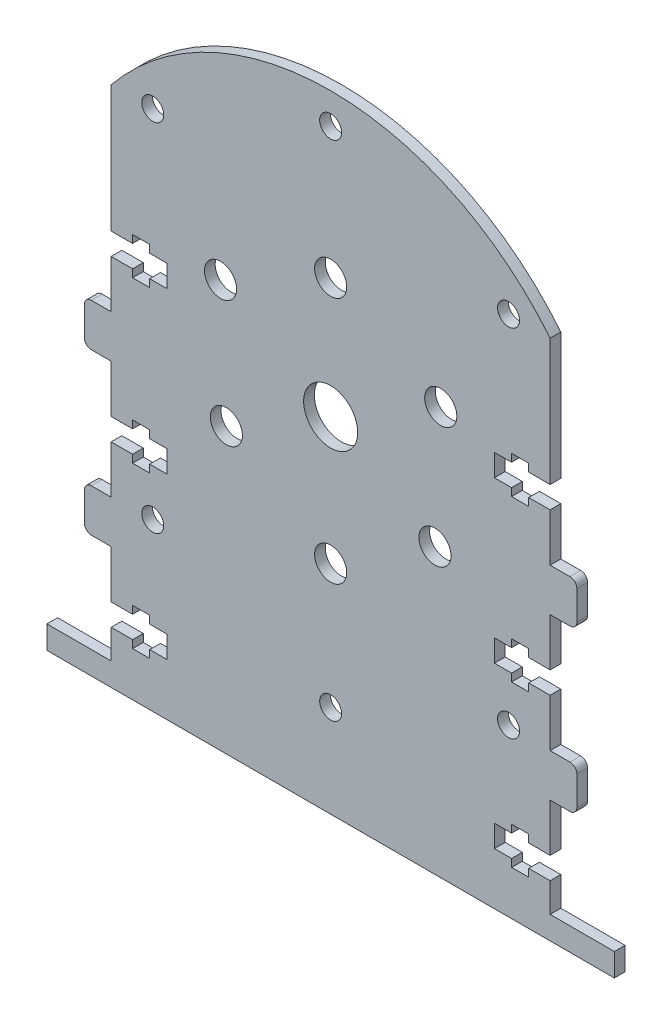
from build123d import *

# Parameters (mm, degrees)
SKETCH_1_R      = 3
SKETCH_1_R_2    = 5.05
SKETCH_1_R_3    = 2.05
EXTRUDE_2_DEPTH = 2
FILLET_1_R      = 1.3


with BuildPart() as part:
    # 草图1 → 凸台-拉伸2 (new body)
    with BuildSketch(Plane.XY):
        with BuildLine():
            Line((-55.962487977, 23.496493589), (-55.962487977, 8.046493589))
            Line((-55.962487977, 8.046493589), (-51.962487977, 8.046493589))
            Line((-51.962487977, 8.046493589), (-51.962487977, 9.496493589))
            Line((-51.962487977, 9.496493589), (-48.762487977, 9.496493589))
            Line((-48.762487977, 9.496493589), (-48.762487977, 8.046493589))
            Line((-48.762487977, 8.046493589), (-45.562487977, 8.046493589))
            Line((-45.562487977, 8.046493589), (-45.562487977, 3.946493589))
            Line((-45.562487977, 3.946493589), (-48.762487977, 3.946493589))
            Line((-48.762487977, 3.946493589), (-48.762487977, 2.496493589))
            Line((-48.762487977, 2.496493589), (-51.962487977, 2.496493589))
            Line((-51.962487977, 2.496493589), (-51.962487977, 3.946493589))
            Line((-51.962487977, 3.946493589), (-55.962487977, 3.946493589))
            Line((-55.962487977, 3.946493589), (-55.962487977, -5.003506411))
            Line((-55.962487977, -5.003506411), (-60.962487977, -5.003506411))
            Line((-60.962487977, -5.003506411), (-60.962487977, -13.003506411))
            Line((-60.962487977, -13.003506411), (-55.962487977, -13.003506411))
            Line((-55.962487977, -13.003506411), (-55.962487977, -21.953506411))
            Line((-55.962487977, -21.953506411), (-51.962487977, -21.953506411))
            Line((-51.962487977, -21.953506411), (-51.962487977, -20.503506411))
            Line((-51.962487977, -20.503506411), (-48.762487977, -20.503506411))
            Line((-48.762487977, -20.503506411), (-48.762487977, -21.953506411))
            Line((-48.762487977, -21.953506411), (-45.562487977, -21.953506411))
            Line((-45.562487977, -21.953506411), (-45.562487977, -26.053506411))
            Line((-45.562487977, -26.053506411), (-48.762487977, -26.053506411))
            Line((-48.762487977, -26.053506411), (-48.762487977, -27.503506411))
            Line((-48.762487977, -27.503506411), (-51.962487977, -27.503506411))
            Line((-51.962487977, -27.503506411), (-51.962487977, -26.053506411))
            Line((-51.962487977, -26.053506411), (-55.962487977, -26.053506411))
            Line((-55.962487977, -26.053506411), (-55.962487977, -35.003506411))
            Line((-55.962487977, -35.003506411), (-60.962487977, -35.003506411))
            Line((-60.962487977, -35.003506411), (-60.962487977, -43.003506411))
            Line((-60.962487977, -43.003506411), (-55.962487977, -43.003506411))
            Line((-55.962487977, -43.003506411), (-55.962487977, -51.953506411))
            Line((-55.962487977, -51.953506411), (-51.962487977, -51.953506411))
            Line((-51.962487977, -51.953506411), (-51.962487977, -50.503506411))
            Line((-51.962487977, -50.503506411), (-48.762487977, -50.503506411))
            Line((-48.762487977, -50.503506411), (-48.762487977, -51.953506411))
            Line((-48.762487977, -51.953506411), (-45.562487977, -51.953506411))
            Line((-45.562487977, -51.953506411), (-45.562487977, -56.053506411))
            Line((-45.562487977, -56.053506411), (-48.762487977, -56.053506411))
            Line((-48.762487977, -56.053506411), (-48.762487977, -57.503506411))
            Line((-48.762487977, -57.503506411), (-51.962487977, -57.503506411))
            Line((-51.962487977, -57.503506411), (-51.962487977, -56.053506411))
            Line((-51.962487977, -56.053506411), (-55.962487977, -56.053506411))
            Line((-55.962487977, -56.053506411), (-55.962487977, -61.503506411))
            Line((-55.962487977, -61.503506411), (-67.962487977, -61.503506411))
            Line((-67.962487977, -61.503506411), (-67.962487977, -65.791888255))
            Line((-67.962487977, -65.791888255), (38.037512023, -65.791888255))
            Line((38.037512023, -65.791888255), (38.037512023, -61.503506411))
            Line((38.037512023, -61.503506411), (26.037512023, -61.503506411))
            Line((26.037512023, -61.503506411), (26.037512023, -56.053506411))
            Line((26.037512023, -56.053506411), (22.037512023, -56.053506411))
            Line((22.037512023, -56.053506411), (22.037512023, -57.503506411))
            Line((22.037512023, -57.503506411), (18.837512023, -57.503506411))
            Line((18.837512023, -57.503506411), (18.837512023, -56.053506411))
            Line((18.837512023, -56.053506411), (15.637512023, -56.053506411))
            Line((15.637512023, -56.053506411), (15.637512023, -51.953506411))
            Line((15.637512023, -51.953506411), (18.837512023, -51.953506411))
            Line((18.837512023, -51.953506411), (18.837512023, -50.503506411))
            Line((18.837512023, -50.503506411), (22.037512023, -50.503506411))
            Line((22.037512023, -50.503506411), (22.037512023, -51.953506411))
            Line((22.037512023, -51.953506411), (26.037512023, -51.953506411))
            Line((26.037512023, -51.953506411), (26.037512023, -43.003506411))
            Line((26.037512023, -43.003506411), (31.037512023, -43.003506411))
            Line((31.037512023, -43.003506411), (31.037512023, -35.003506411))
            Line((31.037512023, -35.003506411), (26.037512023, -35.003506411))
            Line((26.037512023, -35.003506411), (26.037512023, -26.053506411))
            Line((26.037512023, -26.053506411), (22.037512023, -26.053506411))
            Line((22.037512023, -26.053506411), (22.037512023, -27.503506411))
            Line((22.037512023, -27.503506411), (18.837512023, -27.503506411))
            Line((18.837512023, -27.503506411), (18.837512023, -26.053506411))
            Line((18.837512023, -26.053506411), (15.637512023, -26.053506411))
            Line((15.637512023, -26.053506411), (15.637512023, -21.953506411))
            Line((15.637512023, -21.953506411), (18.837512023, -21.953506411))
            Line((18.837512023, -21.953506411), (18.837512023, -20.503506411))
            Line((18.837512023, -20.503506411), (22.037512023, -20.503506411))
            Line((22.037512023, -20.503506411), (22.037512023, -21.953506411))
            Line((22.037512023, -21.953506411), (26.037512023, -21.953506411))
            Line((26.037512023, -21.953506411), (26.037512023, -13.003506411))
            Line((26.037512023, -13.003506411), (31.037512023, -13.003506411))
            Line((31.037512023, -13.003506411), (31.037512023, -5.003506411))
            Line((31.037512023, -5.003506411), (26.037512023, -5.003506411))
            Line((26.037512023, -5.003506411), (26.037512023, 3.946493589))
            Line((26.037512023, 3.946493589), (22.037512023, 3.946493589))
            Line((22.037512023, 3.946493589), (22.037512023, 2.496493589))
            Line((22.037512023, 2.496493589), (18.837512023, 2.496493589))
            Line((18.837512023, 2.496493589), (18.837512023, 3.946493589))
            Line((18.837512023, 3.946493589), (15.637512023, 3.946493589))
            Line((15.637512023, 3.946493589), (15.637512023, 8.046493589))
            Line((15.637512023, 8.046493589), (18.837512023, 8.046493589))
            Line((18.837512023, 8.046493589), (18.837512023, 9.496493589))
            Line((18.837512023, 9.496493589), (22.037512023, 9.496493589))
            Line((22.037512023, 9.496493589), (22.037512023, 8.046493589))
            Line((22.037512023, 8.046493589), (26.037512023, 8.046493589))
            Line((26.037512023, 8.046493589), (26.037512023, 23.496493589))
            Line((26.037512023, 23.496493589), (26.037512023, 31.722989041))
            ThreePointArc((26.037512023, 31.722989041), (-14.962487977, 51.269592797), (-55.962487977, 31.722989041))
            Line((-55.962487977, 31.722989041), (-55.962487977, 23.496493589))
        make_face()
        with Locations((-14.962487977, -25.253506411)):
            Circle(SKETCH_1_R, mode=Mode.SUBTRACT)
        with Locations((4.523083608, -12.753506411)):
            Circle(SKETCH_1_R, mode=Mode.SUBTRACT)
        with Locations((-14.962487977, -1.503506411)):
            Circle(SKETCH_1_R_2, mode=Mode.SUBTRACT)
        with Locations((-35.530591317, 10.371493589)):
            Circle(SKETCH_1_R, mode=Mode.SUBTRACT)
        with Locations((-34.448059562, -12.753506411)):
            Circle(SKETCH_1_R, mode=Mode.SUBTRACT)
        with Locations((5.605615363, 10.371493589)):
            Circle(SKETCH_1_R, mode=Mode.SUBTRACT)
        with Locations((-14.962487977, 20.996493589)):
            Circle(SKETCH_1_R, mode=Mode.SUBTRACT)
        with Locations((18.271530739, -34.737525127)):
            Circle(SKETCH_1_R_3, mode=Mode.SUBTRACT)
        with Locations((-14.962487977, -48.503506411)):
            Circle(SKETCH_1_R_3, mode=Mode.SUBTRACT)
        with Locations((-48.196506692, -34.737525127)):
            Circle(SKETCH_1_R_3, mode=Mode.SUBTRACT)
        with Locations((-48.196506692, 31.730512305)):
            Circle(SKETCH_1_R_3, mode=Mode.SUBTRACT)
        with Locations((-14.962487977, 45.496493589)):
            Circle(SKETCH_1_R_3, mode=Mode.SUBTRACT)
        with Locations((18.271530739, 31.730512305)):
            Circle(SKETCH_1_R_3, mode=Mode.SUBTRACT)
    extrude(amount=EXTRUDE_2_DEPTH)

    # 圆角1
    fillet_1_edges = [part.edges().sort_by_distance(p)[0] for p in [
        (-60.962487977, -43.003506411, 1),
        (-60.962487977, -35.003506411, 1),
        (-60.962487977, -13.003506411, 1),
        (-60.962487977, -5.003506411, 1),
        (31.037512023, -5.003506411, 1),
        (31.037512023, -13.003506411, 1),
        (31.037512023, -35.003506411, 1),
        (31.037512023, -43.003506411, 1),
    ]]
    fillet(fillet_1_edges, radius=FILLET_1_R)


solid = part.part
